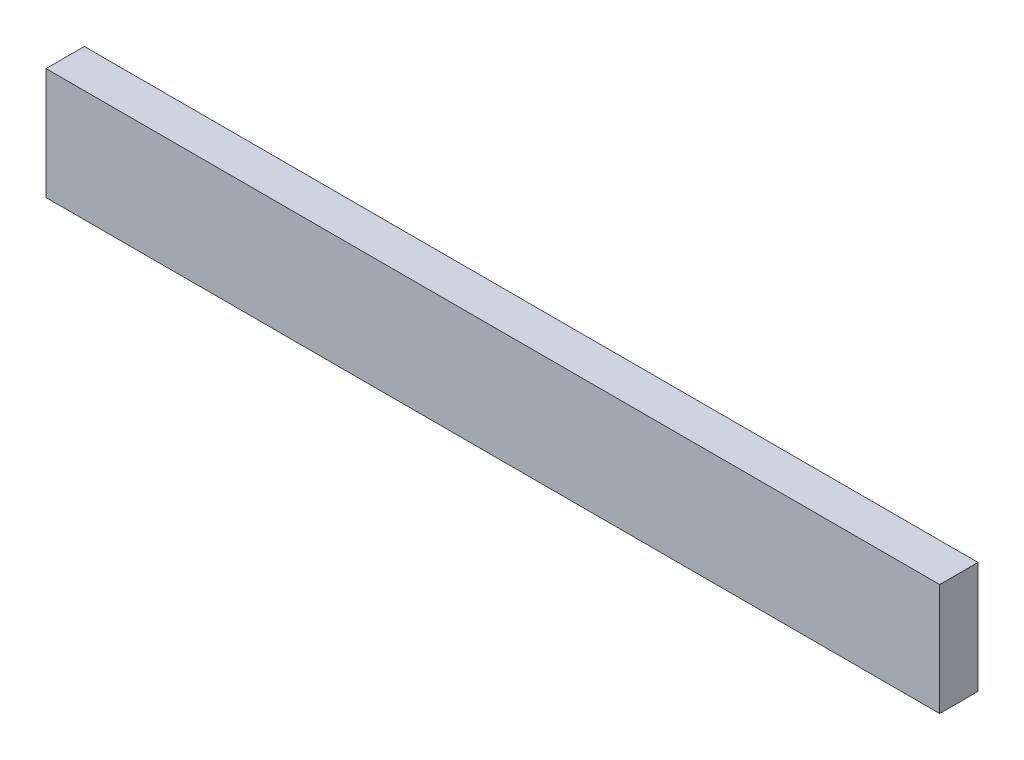
from build123d import *

# Parameters (mm, degrees)
SKETCH_1_W      = 280
SKETCH_1_H      = 35
EXTRUDE_1_DEPTH = 12


with BuildPart() as part:
    # 草图1 → 凸台-拉伸1 (new body)
    with BuildSketch(Plane.XY):
        Rectangle(SKETCH_1_W, SKETCH_1_H)
    extrude(amount=EXTRUDE_1_DEPTH)


solid = part.part
